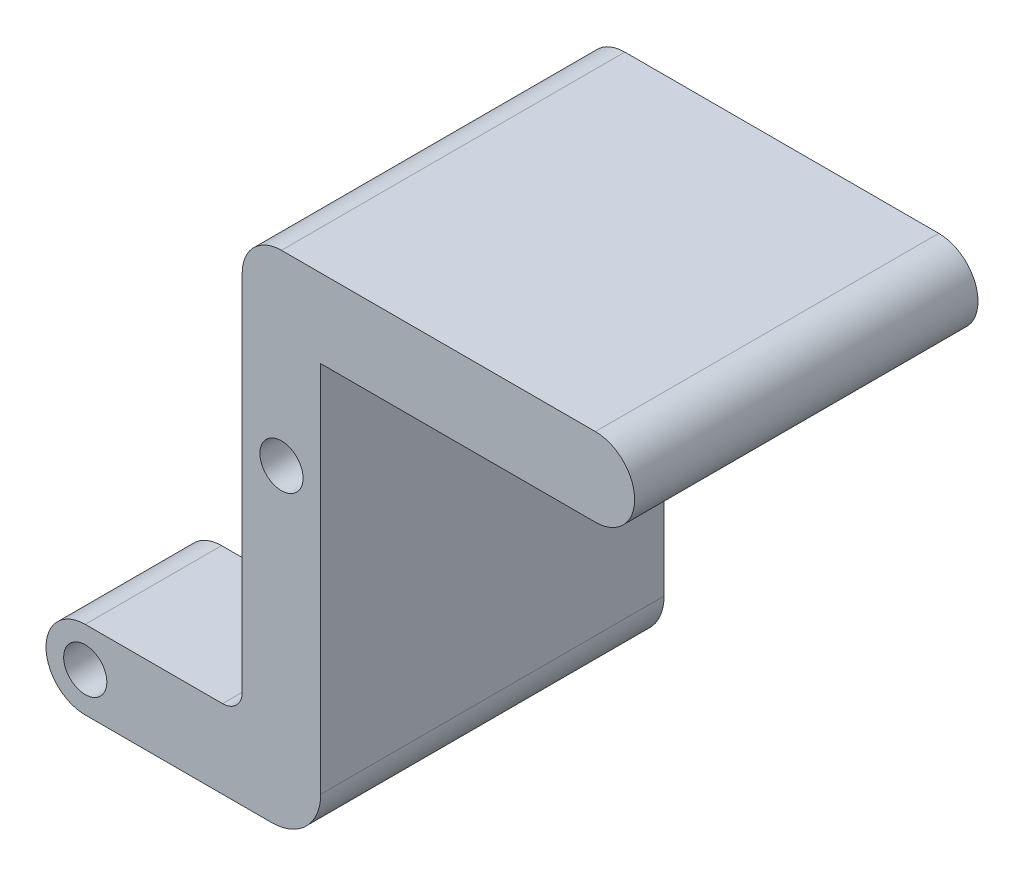
from build123d import *

# Parameters (mm, degrees)
BOSS_EXTRUDE1_DEPTH     = 87.5
SKETCH2_R               = 11
CUT_EXTRUDE1_DEPTH      = 175
FILLET1_R               = 10
FILLET2_R               = 25
CUT_EXTRUDE2_DEPTH      = 18
CUT_EXTRUDE2_DEPTH_BACK = 18
SKETCH3_W               = 40
SKETCH3_H               = 40
BOSS_EXTRUDE2_START     = -175
BOSS_EXTRUDE2_DEPTH     = 175


with BuildPart() as part:
    # Sketch1 → Boss-Extrude1 (new, symmetric)
    with BuildSketch(Plane.XY):
        with BuildLine():
            Line((-20, 20), (-20, 140))
            ThreePointArc((-20, 140), (0, 160), (20, 140))
            Line((20, 140), (20, -20))
            Line((20, -20), (-100, -20))
            ThreePointArc((-100, -20), (-120, 0), (-100, 20))
            Line((-100, 20), (-20, 20))
        make_face()
    extrude(amount=BOSS_EXTRUDE1_DEPTH, both=True)

    # Sketch2 → Cut-Extrude1 (cut)
    with BuildSketch(Plane.XY.offset(87.5)):
        with Locations((-100, 0)):
            Circle(SKETCH2_R)
        with Locations((0, 140)):
            Circle(SKETCH2_R)
    extrude(amount=-CUT_EXTRUDE1_DEPTH, mode=Mode.SUBTRACT)

    # Fillet1
    fillet1_edges = [part.edges().sort_by_distance(p)[0] for p in [
        (-20, 20, 0),
    ]]
    fillet(fillet1_edges, radius=FILLET1_R)

    # Fillet2
    fillet2_edges = [part.edges().sort_by_distance(p)[0] for p in [
        (20, -20, 0),
    ]]
    fillet(fillet2_edges, radius=FILLET2_R)

    # Sketch3 → Cut-Extrude2 (cut, two sides: drawn at the far end of the back side and taken through both)
    with BuildSketch(Plane.XY.offset(-CUT_EXTRUDE2_DEPTH_BACK)):
        with Locations((-100, 0)):
            Rectangle(SKETCH3_W, SKETCH3_H)
    extrude(amount=CUT_EXTRUDE2_DEPTH + CUT_EXTRUDE2_DEPTH_BACK, mode=Mode.SUBTRACT)

    # Sketch4 → Boss-Extrude2 (add)
    with BuildSketch(Plane(origin=(0, 0, -87.5), x_dir=(-1, 0, 0), z_dir=(0, 0, -1)).offset(BOSS_EXTRUDE2_START)):
        with BuildLine():
            ThreePointArc((-20, 140), (0, 160), (20, 140))
            Line((20, 140), (20, 215.09))
            ThreePointArc((20, 215.09), (14.142135624, 229.232135624), (0, 235.09))
            Line((0, 235.09), (-160, 235.09))
            ThreePointArc((-160, 235.09), (-180, 215.09), (-160, 195.09))
            Line((-160, 195.09), (-20, 195.09))
            Line((-20, 195.09), (-20, 140))
        make_face()
    extrude(amount=BOSS_EXTRUDE2_DEPTH)


solid = part.part
